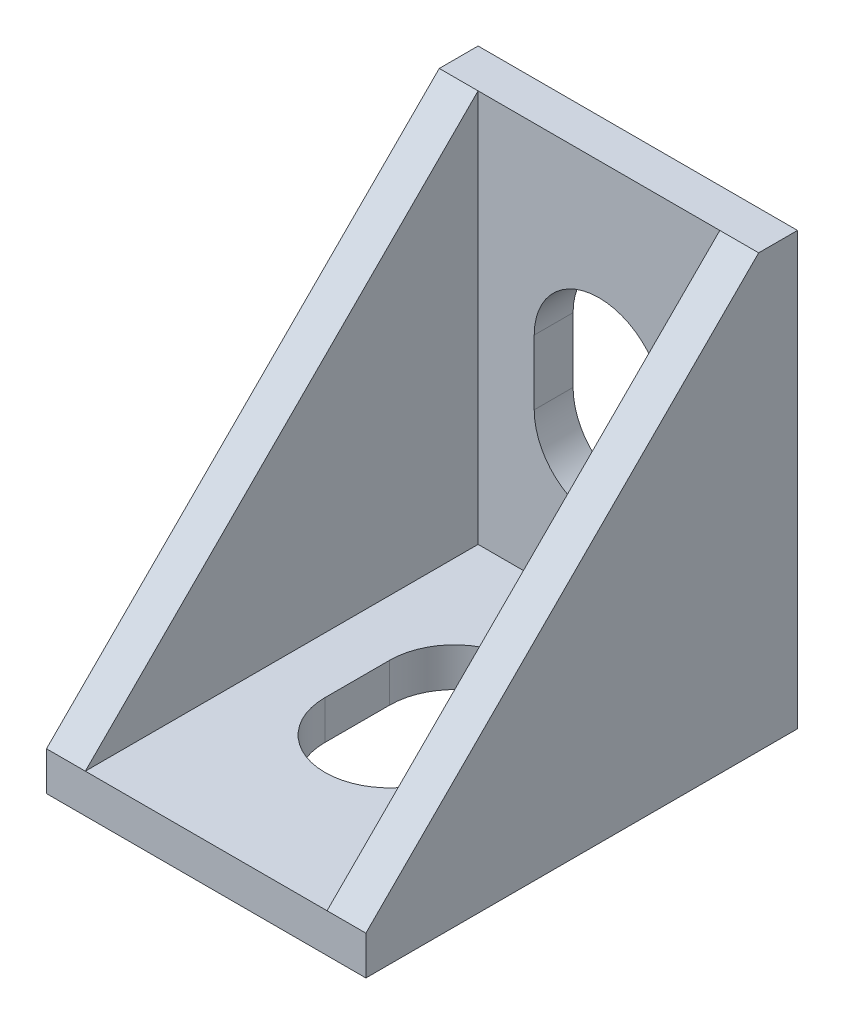
from build123d import *

# Parameters (mm, degrees)
SKETCH1_W           = 14.8
SKETCH1_H           = 20
BOSS_EXTRUDE1_DEPTH = 1.8
SKETCH2_W           = 14.8
SKETCH2_H           = 1.8
BOSS_EXTRUDE2_DEPTH = 18.2
CUT_EXTRUDE2_DEPTH  = 32.922405924
CUT_EXTRUDE3_DEPTH  = 17.2
BOSS_EXTRUDE3_DEPTH = 1.8
BOSS_EXTRUDE4_DEPTH = 1.8


with BuildPart() as part:
    # Sketch1 → Boss-Extrude1 (new body)
    with BuildSketch(Plane(origin=(0, 0, 0), x_dir=(1, 0, 0), z_dir=(0, 1, 0))):
        with Locations((7.4, -10)):
            Rectangle(SKETCH1_W, SKETCH1_H)
    extrude(amount=BOSS_EXTRUDE1_DEPTH)

    # Sketch2 → Boss-Extrude2 (add)
    with BuildSketch(Plane(origin=(0, 1.8, 0), x_dir=(1, 0, 0), z_dir=(0, 1, 0))):
        with Locations((7.4, -0.9)):
            Rectangle(SKETCH2_W, SKETCH2_H)
    extrude(amount=BOSS_EXTRUDE2_DEPTH)

    # Sketch3 → Cut-Extrude2 (cut, through all)
    with BuildSketch(Plane.XZ):
        with BuildLine():
            Line((10.4, 11.5), (10.4, 8.5))
            ThreePointArc((10.4, 8.5), (7.4, 5.5), (4.4, 8.5))
            Line((4.4, 8.5), (4.4, 11.5))
            ThreePointArc((4.4, 11.5), (7.4, 14.5), (10.4, 11.5))
        make_face()
    extrude(amount=-CUT_EXTRUDE2_DEPTH, mode=Mode.SUBTRACT)

    # Sketch5 → Cut-Extrude3 (cut)
    with BuildSketch(Plane(origin=(0, 0, 0), x_dir=(-1, 0, 0), z_dir=(0, 0, -1))):
        with BuildLine():
            Line((-4.4, 11.5), (-4.4, 8.5))
            ThreePointArc((-4.4, 8.5), (-7.4, 5.5), (-10.4, 8.5))
            Line((-10.4, 8.5), (-10.4, 11.5))
            ThreePointArc((-10.4, 11.5), (-7.4, 14.5), (-4.4, 11.5))
        make_face()
    extrude(amount=-CUT_EXTRUDE3_DEPTH, mode=Mode.SUBTRACT)

    # Sketch6 → Boss-Extrude3 (add)
    with BuildSketch(Plane.ZY):
        Polygon((1.8, 20), (1.8, 1.8), (20, 1.8), align=None)
    extrude(amount=-BOSS_EXTRUDE3_DEPTH)

    # Sketch7 → Boss-Extrude4 (add)
    with BuildSketch(Plane(origin=(14.8, 0, 0), x_dir=(0, 0, -1), z_dir=(1, 0, 0))):
        Polygon((-1.8, 20), (-1.8, 1.8), (-20, 1.8), align=None)
    extrude(amount=-BOSS_EXTRUDE4_DEPTH)


solid = part.part
